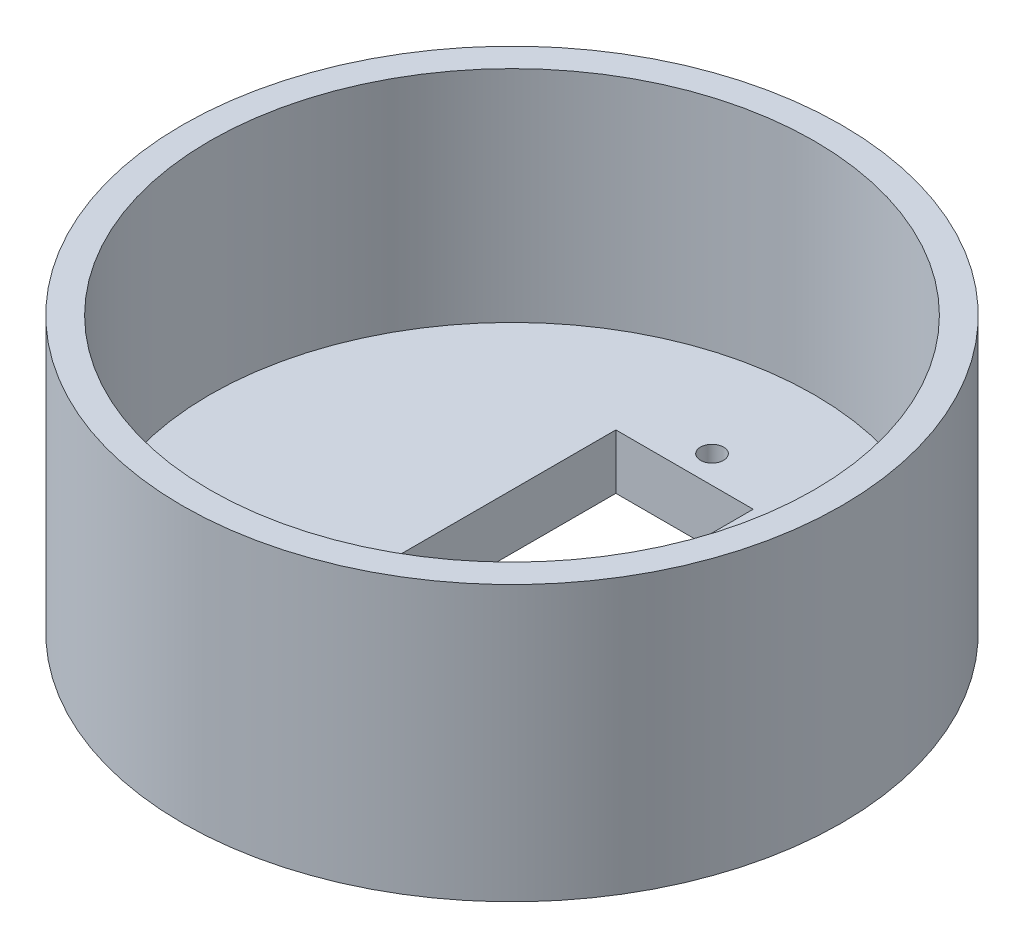
from build123d import *

# Parameters (mm, degrees)
SKETCH1_R           = 30
SKETCH1_W           = 12.5
SKETCH1_H           = 23.2
BOSS_EXTRUDE1_DEPTH = 5
SKETCH4_R           = 30
SKETCH4_R_2         = 27.5
BOSS_EXTRUDE3_DEPTH = 20
CUT_EXTRUDE2_REACH  = 48.904
SKETCH5_R           = 1.05


with BuildPart() as part:
    # Sketch1 → Boss-Extrude1 (new body)
    with BuildSketch(Plane(origin=(0, 0, 0), x_dir=(1, 0, 0), z_dir=(0, 1, 0))):
        with Locations(Location((0, 0, 0), (0, 0, 270))):
            Circle(SKETCH1_R)
        with Locations((0, 4.1)):
            Rectangle(SKETCH1_W, SKETCH1_H, mode=Mode.SUBTRACT)
    extrude(amount=BOSS_EXTRUDE1_DEPTH)

    # Sketch4 → Boss-Extrude3 (add)
    with BuildSketch(Plane(origin=(0, 5, 0), x_dir=(1, 0, 0), z_dir=(0, 1, 0))):
        with Locations(Location((0, 0, 0), (0, 0, 270))):
            Circle(SKETCH4_R)
        with Locations(Location((0, 0, 0), (0, 0, 270))):
            Circle(SKETCH4_R_2, mode=Mode.SUBTRACT)
    extrude(amount=BOSS_EXTRUDE3_DEPTH)

    # Sketch5 → Cut-Extrude2 (cut, up to next)
    with BuildSketch(Plane(origin=(0, 5, 0), x_dir=(1, 0, 0), z_dir=(0, 1, 0)), mode=Mode.PRIVATE) as cut_extrude2_sk1:
        with Locations(Location((0, 18.2, 0), (0, 0, 270))):
            Circle(SKETCH5_R)
    cut_extrude2_tool1 = extrude(cut_extrude2_sk1.sketch, amount=-CUT_EXTRUDE2_REACH, mode=Mode.PRIVATE) & part.part
    # Sketch5 → Cut-Extrude2 (cut, up to next)
    with BuildSketch(Plane(origin=(0, 5, 0), x_dir=(1, 0, 0), z_dir=(0, 1, 0)), mode=Mode.PRIVATE) as cut_extrude2_sk2:
        with Locations(Location((0, -10, 0), (0, 0, 270))):
            Circle(SKETCH5_R)
    cut_extrude2_tool2 = extrude(cut_extrude2_sk2.sketch, amount=-CUT_EXTRUDE2_REACH, mode=Mode.PRIVATE) & part.part
    add(cut_extrude2_tool1.solids().sort_by_distance((0, 5, -18.2))[0], mode=Mode.SUBTRACT)
    add(cut_extrude2_tool2.solids().sort_by_distance((0, 5, 10))[0], mode=Mode.SUBTRACT)


solid = part.part
